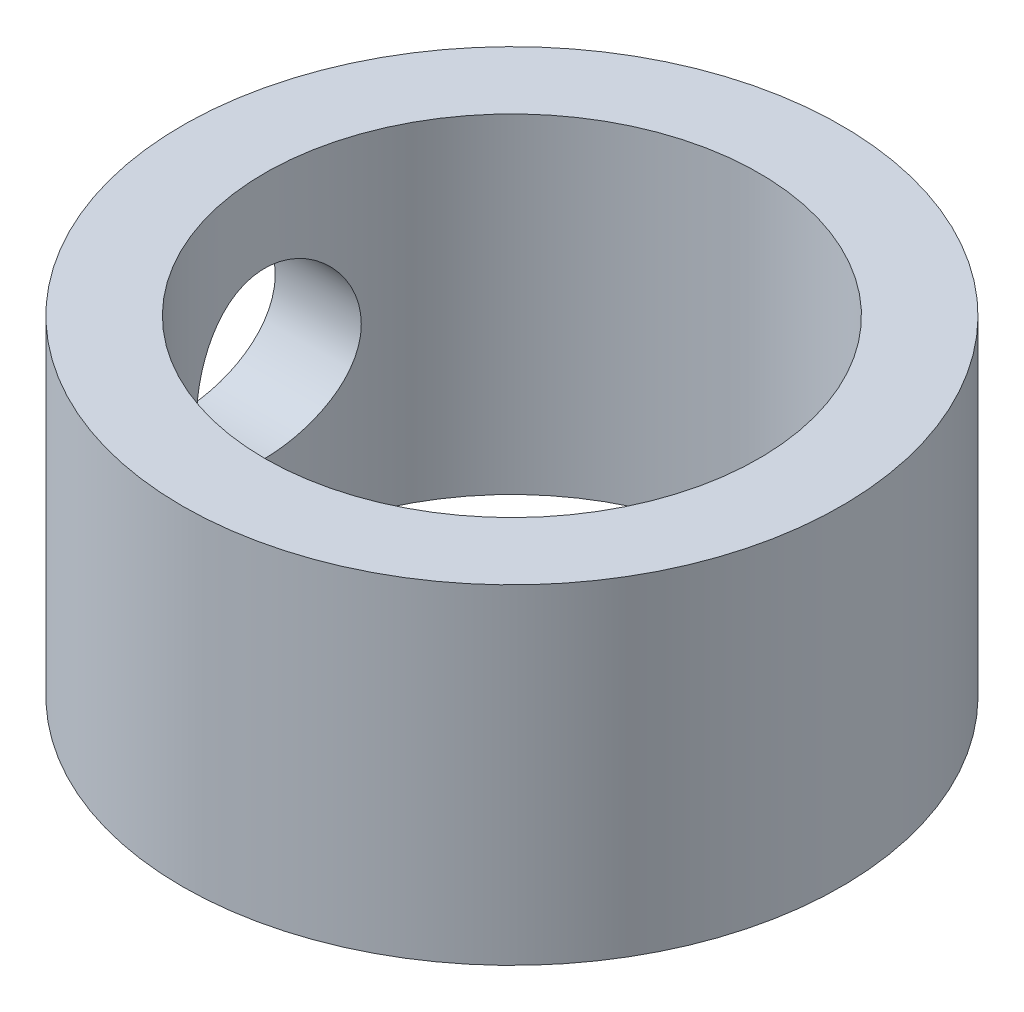
from build123d import *

# Parameters (mm, degrees)
SKETCH1_R           = 4
SKETCH1_R_2         = 3
BOSS_EXTRUDE1_DEPTH = 2
SKETCH2_R           = 1
CUT_EXTRUDE1_DEPTH  = 5


with BuildPart() as part:
    # Sketch1 → Boss-Extrude1 (new, symmetric)
    with BuildSketch(Plane(origin=(0, 0, 0), x_dir=(1, 0, 0), z_dir=(0, 1, 0))):
        with Locations(Location((0, 0, 0), (0, 0, 270))):
            Circle(SKETCH1_R)
        with Locations(Location((0, 0, 0), (0, 0, 270))):
            Circle(SKETCH1_R_2, mode=Mode.SUBTRACT)
    extrude(amount=BOSS_EXTRUDE1_DEPTH, both=True)

    # Sketch2 → Cut-Extrude1 (cut)
    with BuildSketch(Plane(origin=(0, 0, 0), x_dir=(0, 0, -1), z_dir=(1, 0, 0))):
        Circle(SKETCH2_R)
    extrude(amount=-CUT_EXTRUDE1_DEPTH, mode=Mode.SUBTRACT)


solid = part.part
